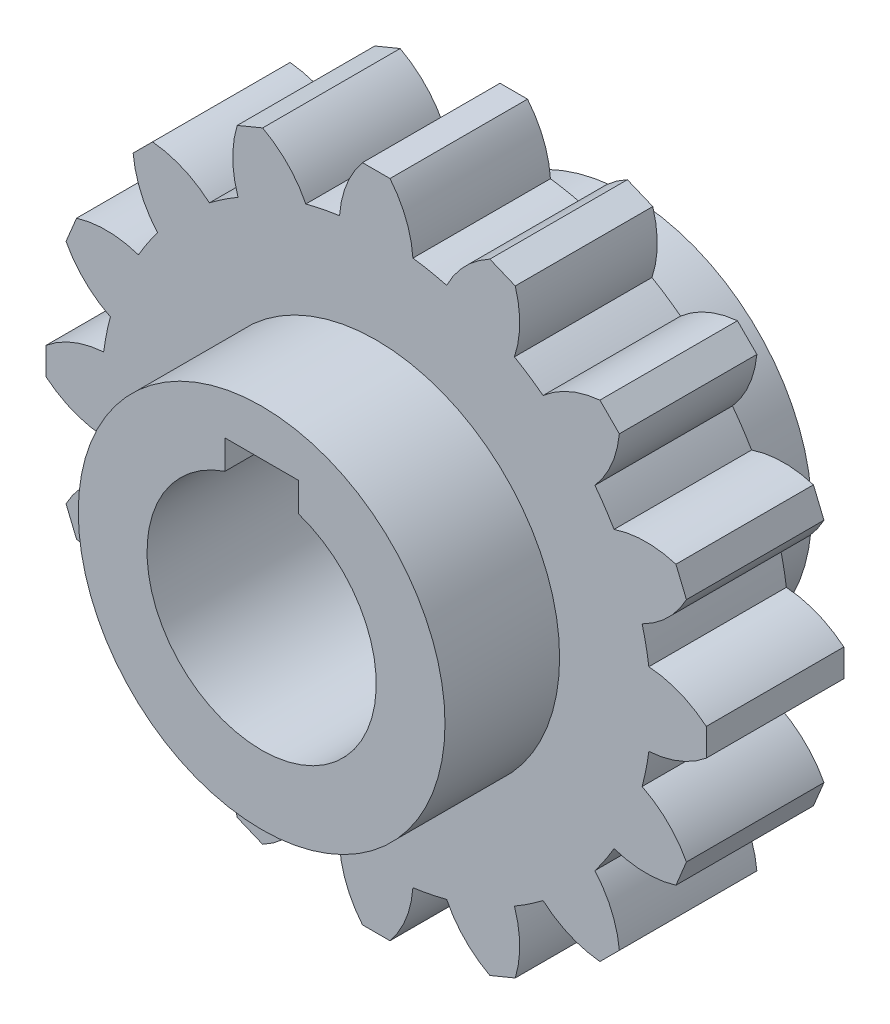
from build123d import *

# Parameters (mm, degrees)
BOSS_EXTRUDE1_DEPTH     = 7.5
SKETCH2_R               = 20
BOSS_EXTRUDE2_DEPTH     = 20
CUT_EXTRUDE1_DEPTH      = 65.745656225
CUT_EXTRUDE1_DEPTH_BACK = 65.745656225


with BuildPart() as part:
    # Sketch1 → Boss-Extrude1 (new, symmetric)
    with BuildSketch(Plane.XY):
        with BuildLine():
            Line((-1.5, 36), (1.5, 36))
            ThreePointArc((1.5, 36), (3.242504384, 33.062509074), (4, 29.732137495))
            ThreePointArc((4, 29.732137495), (5.85270966, 29.423558412), (7.682478298, 28.999647019))
            ThreePointArc((7.682478298, 28.999647019), (9.656791021, 31.786628134), (12.390784266, 33.833688319))
            Line((12.390784266, 33.833688319), (15.162422864, 32.685638022))
            ThreePointArc((15.162422864, 32.685638022), (15.64815789, 29.30492272), (15.073514558, 25.93817956))
            ThreePointArc((15.073514558, 25.93817956), (16.667106991, 24.944088369), (18.195368917, 23.852223166))
            ThreePointArc((18.195368917, 23.852223166), (21.085927531, 25.671521208), (24.395183951, 26.516504294))
            Line((24.395183951, 26.516504294), (26.516504294, 24.395183951))
            ThreePointArc((26.516504294, 24.395183951), (25.671521208, 21.085927531), (23.852223166, 18.195368917))
            ThreePointArc((23.852223166, 18.195368917), (24.944088369, 16.667106991), (25.93817956, 15.073514558))
            ThreePointArc((25.93817956, 15.073514558), (29.30492272, 15.64815789), (32.685638022, 15.162422864))
            Line((32.685638022, 15.162422864), (33.833688319, 12.390784266))
            ThreePointArc((33.833688319, 12.390784266), (31.786628134, 9.656791021), (28.999647019, 7.682478298))
            ThreePointArc((28.999647019, 7.682478298), (29.423558412, 5.85270966), (29.732137495, 4))
            ThreePointArc((29.732137495, 4), (33.062509074, 3.242504384), (36, 1.5))
            Line((36, 1.5), (36, -1.5))
            ThreePointArc((36, -1.5), (33.062509074, -3.242504384), (29.732137495, -4))
            ThreePointArc((29.732137495, -4), (29.423558412, -5.85270966), (28.999647019, -7.682478298))
            ThreePointArc((28.999647019, -7.682478298), (31.786628134, -9.656791021), (33.833688319, -12.390784266))
            Line((33.833688319, -12.390784266), (32.685638022, -15.162422864))
            ThreePointArc((32.685638022, -15.162422864), (29.30492272, -15.64815789), (25.93817956, -15.073514558))
            ThreePointArc((25.93817956, -15.073514558), (24.944088369, -16.667106991), (23.852223166, -18.195368917))
            ThreePointArc((23.852223166, -18.195368917), (25.671521208, -21.085927531), (26.516504294, -24.395183951))
            Line((26.516504294, -24.395183951), (24.395183951, -26.516504294))
            ThreePointArc((24.395183951, -26.516504294), (21.085927531, -25.671521208), (18.195368917, -23.852223166))
            ThreePointArc((18.195368917, -23.852223166), (16.667106991, -24.944088369), (15.073514558, -25.93817956))
            ThreePointArc((15.073514558, -25.93817956), (15.64815789, -29.30492272), (15.162422864, -32.685638022))
            Line((15.162422864, -32.685638022), (12.390784266, -33.833688319))
            ThreePointArc((12.390784266, -33.833688319), (9.656791021, -31.786628134), (7.682478298, -28.999647019))
            ThreePointArc((7.682478298, -28.999647019), (5.85270966, -29.423558412), (4, -29.732137495))
            ThreePointArc((4, -29.732137495), (3.242504384, -33.062509074), (1.5, -36))
            Line((1.5, -36), (-1.5, -36))
            ThreePointArc((-1.5, -36), (-3.242504384, -33.062509074), (-4, -29.732137495))
            ThreePointArc((-4, -29.732137495), (-5.85270966, -29.423558412), (-7.682478298, -28.999647019))
            ThreePointArc((-7.682478298, -28.999647019), (-9.656791021, -31.786628134), (-12.390784266, -33.833688319))
            Line((-12.390784266, -33.833688319), (-15.162422864, -32.685638022))
            ThreePointArc((-15.162422864, -32.685638022), (-15.64815789, -29.30492272), (-15.073514558, -25.93817956))
            ThreePointArc((-15.073514558, -25.93817956), (-16.667106991, -24.944088369), (-18.195368917, -23.852223166))
            ThreePointArc((-18.195368917, -23.852223166), (-21.085927531, -25.671521208), (-24.395183951, -26.516504294))
            Line((-24.395183951, -26.516504294), (-26.516504294, -24.395183951))
            ThreePointArc((-26.516504294, -24.395183951), (-25.671521208, -21.085927531), (-23.852223166, -18.195368917))
            ThreePointArc((-23.852223166, -18.195368917), (-24.944088369, -16.667106991), (-25.93817956, -15.073514558))
            ThreePointArc((-25.93817956, -15.073514558), (-29.30492272, -15.64815789), (-32.685638022, -15.162422864))
            Line((-32.685638022, -15.162422864), (-33.833688319, -12.390784266))
            ThreePointArc((-33.833688319, -12.390784266), (-31.786628134, -9.656791021), (-28.999647019, -7.682478298))
            ThreePointArc((-28.999647019, -7.682478298), (-29.423558412, -5.85270966), (-29.732137495, -4))
            ThreePointArc((-29.732137495, -4), (-33.062509074, -3.242504384), (-36, -1.5))
            Line((-36, -1.5), (-36, 1.5))
            ThreePointArc((-36, 1.5), (-33.062509074, 3.242504384), (-29.732137495, 4))
            ThreePointArc((-29.732137495, 4), (-29.423558412, 5.85270966), (-28.999647019, 7.682478298))
            ThreePointArc((-28.999647019, 7.682478298), (-31.786628134, 9.656791021), (-33.833688319, 12.390784266))
            Line((-33.833688319, 12.390784266), (-32.685638022, 15.162422864))
            ThreePointArc((-32.685638022, 15.162422864), (-29.30492272, 15.64815789), (-25.93817956, 15.073514558))
            ThreePointArc((-25.93817956, 15.073514558), (-24.944088369, 16.667106991), (-23.852223166, 18.195368917))
            ThreePointArc((-23.852223166, 18.195368917), (-25.671521208, 21.085927531), (-26.516504294, 24.395183951))
            Line((-26.516504294, 24.395183951), (-24.395183951, 26.516504294))
            ThreePointArc((-24.395183951, 26.516504294), (-21.085927531, 25.671521208), (-18.195368917, 23.852223166))
            ThreePointArc((-18.195368917, 23.852223166), (-16.667106991, 24.944088369), (-15.073514558, 25.93817956))
            ThreePointArc((-15.073514558, 25.93817956), (-15.64815789, 29.30492272), (-15.162422864, 32.685638022))
            Line((-15.162422864, 32.685638022), (-12.390784266, 33.833688319))
            ThreePointArc((-12.390784266, 33.833688319), (-9.656791021, 31.786628134), (-7.682478298, 28.999647019))
            ThreePointArc((-7.682478298, 28.999647019), (-5.85270966, 29.423558412), (-4, 29.732137495))
            ThreePointArc((-4, 29.732137495), (-3.242504384, 33.062509074), (-1.5, 36))
        make_face()
    extrude(amount=BOSS_EXTRUDE1_DEPTH, both=True)

    # Sketch2 → Boss-Extrude2 (add, symmetric)
    with BuildSketch(Plane.XY):
        with Locations(Location((0, 0, 0), (0, 0, 180))):
            Circle(SKETCH2_R)
    extrude(amount=BOSS_EXTRUDE2_DEPTH, both=True)

    # Sketch3 → Cut-Extrude1 (cut, two sides: drawn at the far end of the back side and taken through both)
    with BuildSketch(Plane.XY.offset(20).offset(-CUT_EXTRUDE1_DEPTH_BACK)):
        with BuildLine():
            Line((-4, 15), (-4, 11.842719282))
            ThreePointArc((-4, 11.842719282), (0, -12.5), (4, 11.842719282))
            Line((4, 11.842719282), (4, 15))
            Line((4, 15), (-4, 15))
        make_face()
    extrude(amount=CUT_EXTRUDE1_DEPTH + CUT_EXTRUDE1_DEPTH_BACK, mode=Mode.SUBTRACT)


solid = part.part
